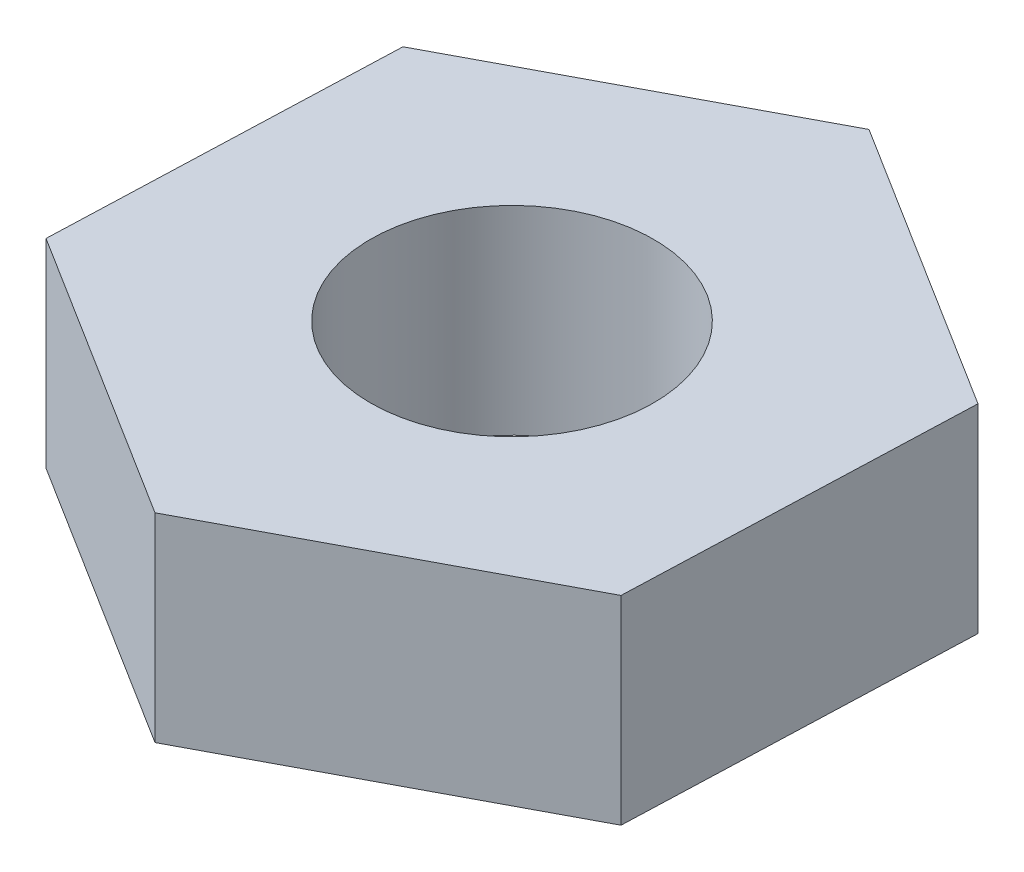
from build123d import *

# Parameters (mm, degrees)
BOSS_EXTRUDE1_DEPTH   = 1.5875
F_4_40_TAPPED_HOLE1_D = 2.2606


with BuildPart() as part:
    # Sketch1 → Boss-Extrude1 (new body)
    with BuildSketch(Plane(origin=(0, 0, 0), x_dir=(1, 0, 0), z_dir=(0, 1, 0))):
        Polygon((2.329791082, -1.460322658), (2.42957206, 1.287496934), (0.099780978, 2.747819591), (-2.329791082, 1.460322658), (-2.42957206, -1.287496934), (-0.099780978, -2.747819591), align=None)
    extrude(amount=BOSS_EXTRUDE1_DEPTH)

    # #4-40 Tapped Hole1 (through all)
    with Locations(Plane(origin=(0, 1.5875, 0), x_dir=(1, 0, 0), z_dir=(0, 1, 0))):
        with Locations((0, 0)):
            Hole(F_4_40_TAPPED_HOLE1_D / 2)


solid = part.part
